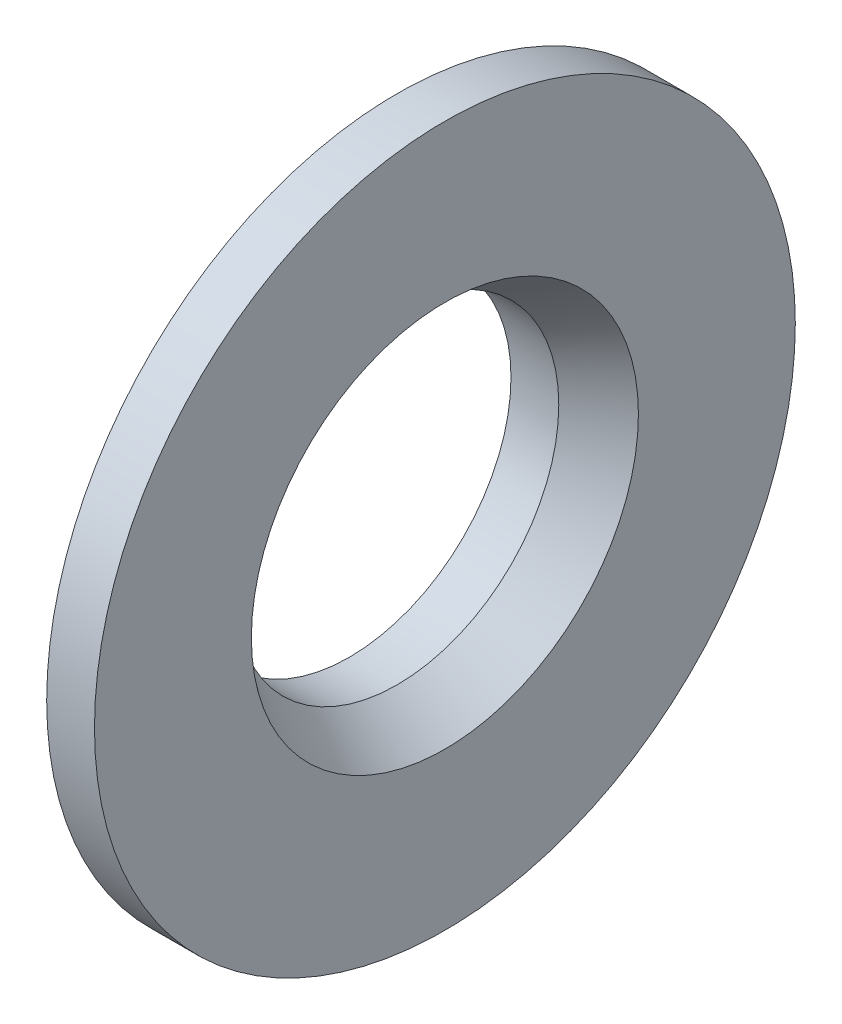
from build123d import *


with BuildPart() as part:
    # 草图1 → 旋转1 (revolve)
    with BuildSketch(Plane.XY, mode=Mode.PRIVATE) as revolve_1_sk:
        Polygon((6, 12.15), (6, 22), (3, 22), (3, 15), (0, 13), (0, 10.15), (3, 10.15), align=None)
    revolve(revolve_1_sk.sketch.rotate(Axis((0, 0, 0), (1, 0, 0)), 90), axis=Axis((0, 0, 0), (1, 0, 0)))


solid = part.part
